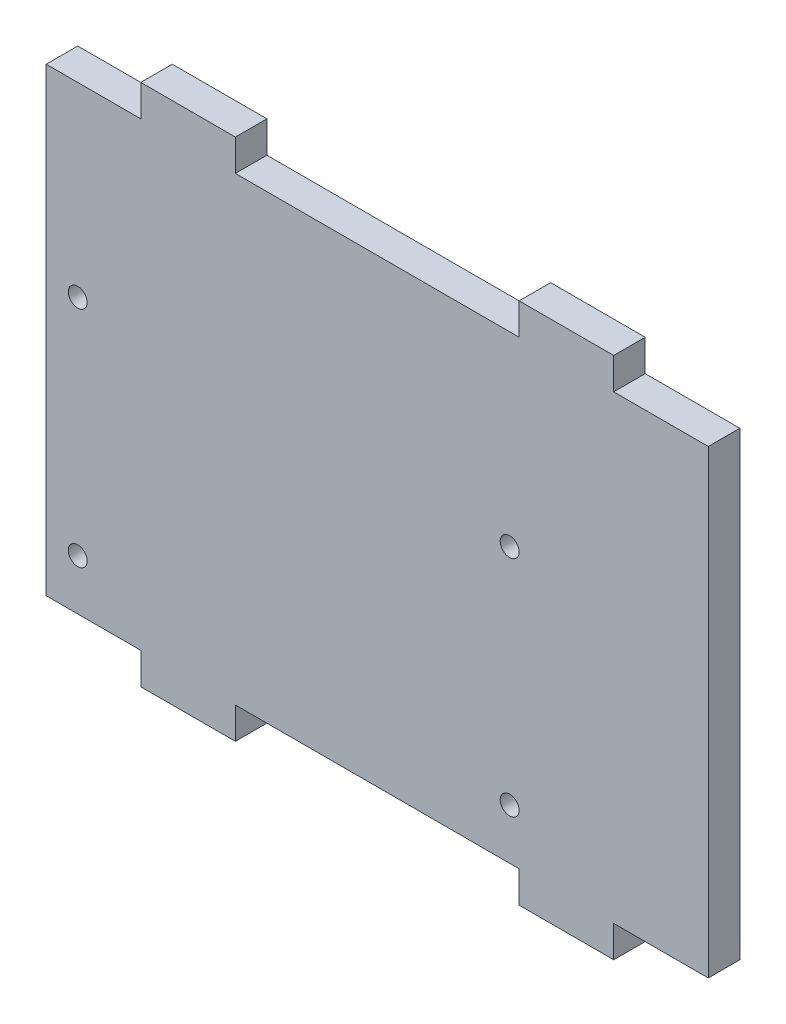
from build123d import *

# Parameters (mm, degrees)
ESQUISSE1_W             = 105
ESQUISSE1_H             = 73
BOSS_EXTRU_1_DEPTH      = 5
ESQUISSE2_R             = 1.5
ENL_V_MAT_EXTRU_1_DEPTH = 5
ESQUISSE3_W             = 15
ESQUISSE3_H             = 5
BOSS_EXTRU_2_DEPTH      = 5


with BuildPart() as part:
    # Esquisse1 → Boss.-Extru.1 (new body)
    with BuildSketch(Plane.XY):
        with Locations((-122.358209677, 115.559145013)):
            Rectangle(ESQUISSE1_W, ESQUISSE1_H)
    extrude(amount=BOSS_EXTRU_1_DEPTH)

    # Esquisse2 → Enlèv. mat.-Extru.1 (cut)
    with BuildSketch(Plane.XY.offset(5)):
        with Locations((-101.358209677, 122.559145013)):
            Circle(ESQUISSE2_R)
        with Locations((-169.858209677, 122.559145013)):
            Circle(ESQUISSE2_R)
        with Locations((-169.858209677, 87.059145013)):
            Circle(ESQUISSE2_R)
        with Locations((-101.358209677, 87.059145013)):
            Circle(ESQUISSE2_R)
    extrude(amount=-ENL_V_MAT_EXTRU_1_DEPTH, mode=Mode.SUBTRACT)

    # Esquisse3 → Boss.-Extru.2 (add)
    with BuildSketch(Plane.XY.offset(5)):
        with Locations((-152.358209677, 76.559145013)):
            Rectangle(ESQUISSE3_W, ESQUISSE3_H)
        with Locations((-92.358209677, 76.559145013)):
            Rectangle(ESQUISSE3_W, ESQUISSE3_H)
        with Locations((-92.358209677, 154.559145013)):
            Rectangle(ESQUISSE3_W, ESQUISSE3_H)
        with Locations((-152.358209677, 154.559145013)):
            Rectangle(ESQUISSE3_W, ESQUISSE3_H)
    extrude(amount=-BOSS_EXTRU_2_DEPTH)


solid = part.part
